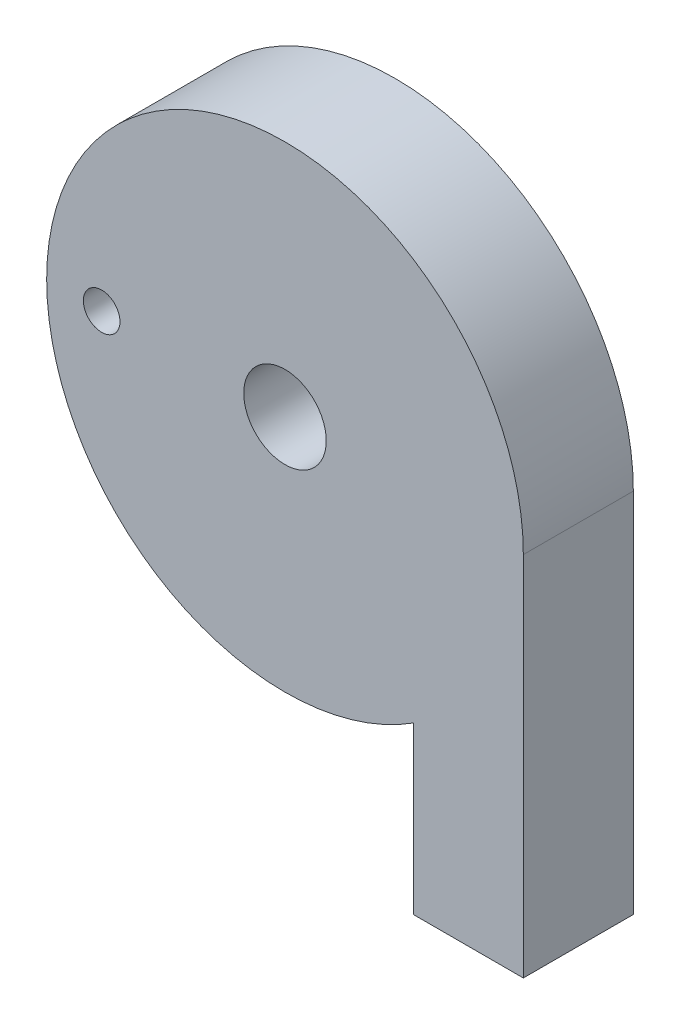
from build123d import *

# Parameters (mm, degrees)
BOSS_EXTRUDE1_DEPTH  = 3
M4_CLEARANCE_HOLE1_D = 4.5
SKETCH5_R            = 1.5875
CUT_EXTRUDE1_DEPTH   = 20
SKETCH7_R            = 1
CUT_EXTRUDE2_DEPTH   = 25.596747752


with BuildPart() as part:
    # Sketch2 → Boss-Extrude1 (new, symmetric)
    with BuildSketch(Plane.XY):
        with BuildLine():
            Line((13, 0), (13, -20))
            Line((13, -20), (7, -20))
            Line((7, -20), (7, -10.95445115))
            ThreePointArc((7, -10.95445115), (-11.401754251, 6.244997998), (13, 0))
        make_face()
    extrude(amount=BOSS_EXTRUDE1_DEPTH, both=True)

    # M4 Clearance Hole1 (through all)
    with Locations(Plane.XY.offset(3)):
        with Locations((0, 0)):
            Hole(M4_CLEARANCE_HOLE1_D / 2)

    # Sketch5 → Cut-Extrude1 (cut)
    with BuildSketch(Plane.XZ.offset(20)):
        with Locations(Location((10, 0, 0), (0, 0, 270))):
            Circle(SKETCH5_R)
    extrude(amount=-CUT_EXTRUDE1_DEPTH, mode=Mode.SUBTRACT)

    # Sketch7 → Cut-Extrude2 (cut, through all)
    with BuildSketch(Plane.XY.offset(3)):
        with Locations((-10, 0)):
            Circle(SKETCH7_R)
    extrude(amount=-CUT_EXTRUDE2_DEPTH, mode=Mode.SUBTRACT)


solid = part.part
